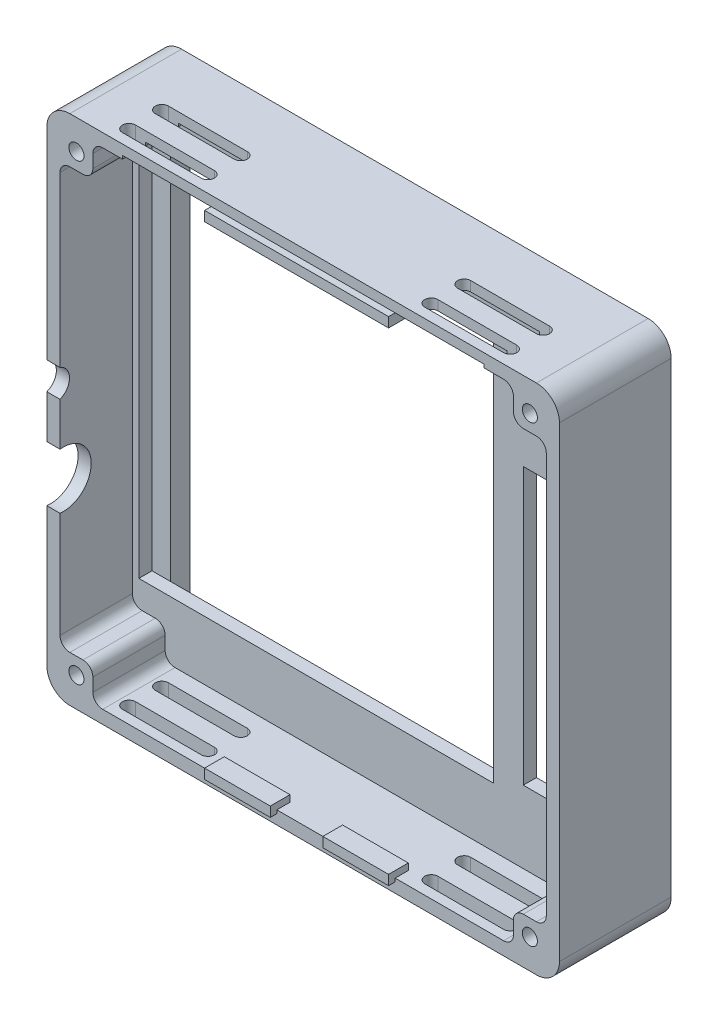
from build123d import *

# Parameters (mm, degrees)
SKETCH_1_W           = 78
SKETCH_1_H           = 78
EXTRUDE_1_DEPTH      = 6
SKETCH_2_W           = 78
SKETCH_2_H           = 78
SKETCH_2_W_2         = 74
SKETCH_2_H_2         = 74
SKETCH_2_W_3         = 5
SKETCH_2_H_3         = 5
EXTRUDE_2_DEPTH      = 11
FILLET_1_R           = 1.5
FILLET_2_R           = 3.5
CUT_EXTRUDE_1_DEPTH  = 1
CUT_EXTRUDE_2_DEPTH  = 3
SKETCH_5_R           = 1.15
CUT_EXTRUDE_3_DEPTH  = 58.428216061
SKETCH_6_W           = 55
SKETCH_6_H           = 2
SKETCH_6_W_2         = 54
SKETCH_6_H_2         = 58
SKETCH_6_W_3         = 12.5
SKETCH_6_H_3         = 42
CUT_EXTRUDE_4_DEPTH  = 57.665686266
EXTRUDE_3_DEPTH      = 1
EXTRUDE_3_DEPTH_BACK = 2
SKETCH_7_W           = 10
SKETCH_7_H           = 1.5
SKETCH_7_W_2         = 28
SKETCH_8_R           = 4.25
SKETCH_8_R_2         = 2.247220505
CUT_EXTRUDE_5_DEPTH  = 10
CUT_EXTRUDE_6_DEPTH  = 90.044932478
SKETCH_10_W          = 1.3
SKETCH_10_H          = 2.3
CUT_EXTRUDE_7_DEPTH  = 3


with BuildPart() as part:
    # 草图1 → 凸台-拉伸1 (new body)
    with BuildSketch(Plane.XY):
        Rectangle(SKETCH_1_W, SKETCH_1_H)
    extrude(amount=EXTRUDE_1_DEPTH)

    # 草图2 → 凸台-拉伸2 (add)
    # profile 1 of 5: a face of its own
    with BuildSketch(Plane.XY.offset(6)):
        Rectangle(SKETCH_2_W, SKETCH_2_H)
        Rectangle(SKETCH_2_W_2, SKETCH_2_H_2, mode=Mode.SUBTRACT)
    # profile 2 of 5: a face of its own
    with BuildSketch(Plane.XY.offset(6)):
        with Locations((-34.5, 34.5)):
            Rectangle(SKETCH_2_W_3, SKETCH_2_H_3)
    # profile 3 of 5: a face of its own
    with BuildSketch(Plane.XY.offset(6)):
        with Locations((34.5, 34.5)):
            Rectangle(SKETCH_2_W_3, SKETCH_2_H_3)
    # profile 4 of 5: a face of its own
    with BuildSketch(Plane.XY.offset(6)):
        with Locations((34.5, -34.5)):
            Rectangle(SKETCH_2_W_3, SKETCH_2_H_3)
    # profile 5 of 5: a face of its own
    with BuildSketch(Plane.XY.offset(6)):
        with Locations((-34.5, -34.5)):
            Rectangle(SKETCH_2_W_3, SKETCH_2_H_3)
    extrude(amount=EXTRUDE_2_DEPTH)

    # 圆角1
    fillet_1_edges = [part.edges().sort_by_distance(p)[0] for p in [
        (-37, -32, 11.5),
        (-37, 32, 11.5),
        (-32, 32, 11.5),
        (-32, 37, 11.5),
        (32, 37, 11.5),
        (32, 32, 11.5),
        (37, 32, 11.5),
        (37, -32, 11.5),
        (32, -32, 11.5),
        (32, -37, 11.5),
        (-32, -37, 11.5),
        (-32, -32, 11.5),
    ]]
    fillet(fillet_1_edges, radius=FILLET_1_R)

    # 圆角2
    fillet_2_edges = [part.edges().sort_by_distance(p)[0] for p in [
        (39, -39, 8.5),
        (-39, -39, 8.5),
        (-39, 39, 8.5),
        (39, 39, 8.5),
    ]]
    fillet(fillet_2_edges, radius=FILLET_2_R)

    # 草图3 → 切除-拉伸1 (cut)
    with BuildSketch(Plane(origin=(0, 0, 0), x_dir=(-1, 0, 0), z_dir=(0, 0, -1))):
        with BuildLine():
            Line((37.5, -35.5), (37.5, 35.5))
            ThreePointArc((37.5, 35.5), (36.914213562, 36.914213562), (35.5, 37.5))
            Line((35.5, 37.5), (-35.5, 37.5))
            ThreePointArc((-35.5, 37.5), (-36.914213562, 36.914213562), (-37.5, 35.5))
            Line((-37.5, 35.5), (-37.5, -35.5))
            ThreePointArc((-37.5, -35.5), (-36.914213562, -36.914213562), (-35.5, -37.5))
            Line((-35.5, -37.5), (35.5, -37.5))
            ThreePointArc((35.5, -37.5), (36.914213562, -36.914213562), (37.5, -35.5))
        make_face()
    extrude(amount=-CUT_EXTRUDE_1_DEPTH, mode=Mode.SUBTRACT)

    # 草图4 → 切除-拉伸2 (cut)
    with BuildSketch(Plane(origin=(0, 0, 1), x_dir=(-1, 0, 0), z_dir=(0, 0, -1))):
        Polygon((27.5, 37.5), (-27.5, 37.5), (-27.5, 37.1), (-33.2, 37.1), (-33.2, -33.5), (33.2, -33.5), (33.2, 37.1), (27.5, 37.1), align=None)
    extrude(amount=-CUT_EXTRUDE_2_DEPTH, mode=Mode.SUBTRACT)

    # 草图5 → 切除-拉伸3 (cut, through all)
    with BuildSketch(Plane(origin=(0, 0, 1), x_dir=(-1, 0, 0), z_dir=(0, 0, -1))):
        with Locations((-34.5, 34.5)):
            Circle(SKETCH_5_R)
        with Locations((34.5, 34.5)):
            Circle(SKETCH_5_R)
        with Locations((34.5, -34.5)):
            Circle(SKETCH_5_R)
        with Locations((-34.5, -34.5)):
            Circle(SKETCH_5_R)
    extrude(amount=-CUT_EXTRUDE_3_DEPTH, mode=Mode.SUBTRACT)

    # 草图6 → 切除-拉伸4 (cut, through all)
    with BuildSketch(Plane(origin=(0, 0, 4), x_dir=(-1, 0, 0), z_dir=(0, 0, -1))):
        with Locations((0, 36.5)):
            Rectangle(SKETCH_6_W, SKETCH_6_H)
        with Locations((9, 1)):
            Rectangle(SKETCH_6_W_2, SKETCH_6_H_2)
        with Locations((-28.75, -5)):
            Rectangle(SKETCH_6_W_3, SKETCH_6_H_3)
    extrude(amount=-CUT_EXTRUDE_4_DEPTH, mode=Mode.SUBTRACT)

    # 草图7 → 凸台-拉伸3 (add, two sides: drawn at the far end of the back side and taken through both)
    with BuildSketch(Plane.XY.offset(17).offset(-EXTRUDE_3_DEPTH_BACK)):
        with Locations((9, -36.75)):
            Rectangle(SKETCH_7_W, SKETCH_7_H)
        with Locations((-9, -36.75)):
            Rectangle(SKETCH_7_W, SKETCH_7_H)
        with Locations((0, 36.75)):
            Rectangle(SKETCH_7_W_2, SKETCH_7_H)
    extrude(amount=EXTRUDE_3_DEPTH + EXTRUDE_3_DEPTH_BACK)

    # 草图8 → 切除-拉伸5 (cut)
    with BuildSketch(Plane(origin=(-39, 0, 0), x_dir=(0, 0, -1), z_dir=(1, 0, 0))):
        with Locations((-16.5, -10.2)):
            Circle(SKETCH_8_R)
        with Locations((-17.8, 2.7)):
            Circle(SKETCH_8_R_2)
    extrude(amount=CUT_EXTRUDE_5_DEPTH, mode=Mode.SUBTRACT)

    # 草图9 → 切除-拉伸6 (cut, through all)
    with BuildSketch(Plane.XZ.offset(39)):
        with BuildLine():
            Line((-29, 15.5), (-17, 15.5))
            ThreePointArc((-17, 15.5), (-16, 14.5), (-17, 13.5))
            Line((-17, 13.5), (-29, 13.5))
            ThreePointArc((-29, 13.5), (-30, 14.5), (-29, 15.5))
        make_face()
        with BuildLine():
            Line((-29, 10.5), (-17, 10.5))
            ThreePointArc((-17, 10.5), (-16, 9.5), (-17, 8.5))
            Line((-17, 8.5), (-29, 8.5))
            ThreePointArc((-29, 8.5), (-30, 9.5), (-29, 10.5))
        make_face()
        with BuildLine():
            Line((29, 10.5), (17, 10.5))
            ThreePointArc((17, 10.5), (16, 9.5), (17, 8.5))
            Line((17, 8.5), (29, 8.5))
            ThreePointArc((29, 8.5), (30, 9.5), (29, 10.5))
        make_face()
        with BuildLine():
            Line((29, 15.5), (17, 15.5))
            ThreePointArc((17, 15.5), (16, 14.5), (17, 13.5))
            Line((17, 13.5), (29, 13.5))
            ThreePointArc((29, 13.5), (30, 14.5), (29, 15.5))
        make_face()
    extrude(amount=-CUT_EXTRUDE_6_DEPTH, mode=Mode.SUBTRACT)

    # 草图10 → 切除-拉伸7 (cut)
    with BuildSketch(Plane(origin=(0, 0, 1), x_dir=(-1, 0, 0), z_dir=(0, 0, -1))):
        with Locations((-33.85, 34.5)):
            Rectangle(SKETCH_10_W, SKETCH_10_H)
        with Locations((33.85, 34.5)):
            Rectangle(SKETCH_10_W, SKETCH_10_H)
    extrude(amount=-CUT_EXTRUDE_7_DEPTH, mode=Mode.SUBTRACT)


solid = part.part
